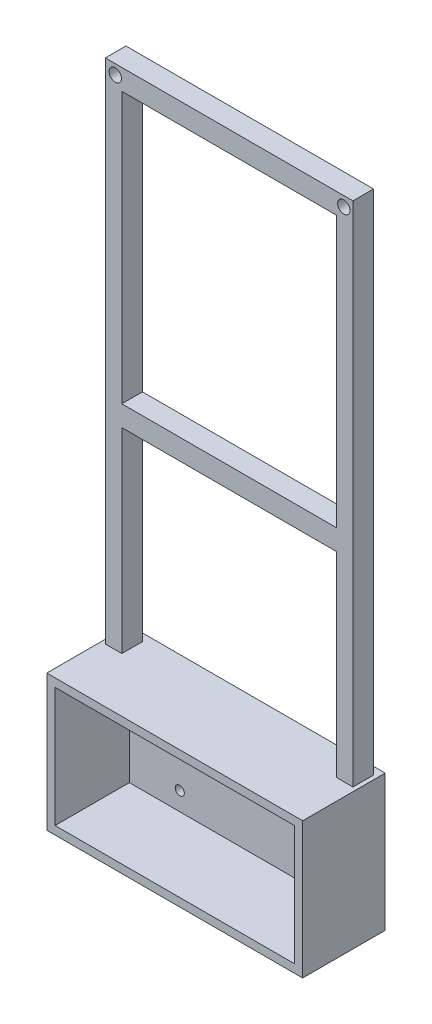
from build123d import *

# Parameters (mm, degrees)
SKETCH1_W           = 62
SKETCH1_H           = 33
BOSS_EXTRUDE1_DEPTH = 20
SHELL1_T            = -2
SKETCH2_W           = 4
SKETCH2_H           = 5
BOSS_EXTRUDE2_DEPTH = 123
SKETCH3_W           = 5
SKETCH3_H           = 5
BOSS_EXTRUDE3_DEPTH = 53
SKETCH4_W           = 5
SKETCH4_H           = 4.999777887
BOSS_EXTRUDE4_DEPTH = 53
SKETCH5_R           = 1.5
CUT_EXTRUDE1_DEPTH  = 53
SKETCH6_R           = 1.1
CUT_EXTRUDE2_DEPTH  = 10


with BuildPart() as part:
    # Sketch1 → Boss-Extrude1 (new body)
    with BuildSketch(Plane.XY):
        Rectangle(SKETCH1_W, SKETCH1_H)
    extrude(amount=BOSS_EXTRUDE1_DEPTH)

    # Shell1
    shell1_openings = [part.faces().sort_by_distance(p)[0] for p in [
        (0, 0, 20),
    ]]
    offset(amount=SHELL1_T, openings=shell1_openings, kind=Kind.INTERSECTION)

    # Sketch2 → Boss-Extrude2 (add)
    with BuildSketch(Plane(origin=(0, 16.5, 0), x_dir=(1, 0, 0), z_dir=(0, 1, 0))):
        with Locations((-28, -4.324522586)):
            Rectangle(SKETCH2_W, SKETCH2_H)
        with Locations((28, -4.324522586)):
            Rectangle(SKETCH2_W, SKETCH2_H)
    extrude(amount=BOSS_EXTRUDE2_DEPTH)

    # Sketch3 → Boss-Extrude3 (add)
    with BuildSketch(Plane(origin=(-26, 0, 0), x_dir=(0, 0, -1), z_dir=(1, 0, 0))):
        with Locations((-4.324522586, 66.417337004)):
            Rectangle(SKETCH3_W, SKETCH3_H)
    extrude(amount=BOSS_EXTRUDE3_DEPTH)

    # Sketch4 → Boss-Extrude4 (add)
    with BuildSketch(Plane(origin=(-26, 0, 0), x_dir=(0, 0, -1), z_dir=(1, 0, 0))):
        with Locations((-4.324522586, 137.000111057)):
            Rectangle(SKETCH4_W, SKETCH4_H)
    extrude(amount=BOSS_EXTRUDE4_DEPTH)

    # Sketch5 → Cut-Extrude1 (cut)
    with BuildSketch(Plane.XY.offset(6.824522586)):
        with Locations((-27.588179803, 137.122373113)):
            Circle(SKETCH5_R)
        with Locations((27.802254523, 137.122373113)):
            Circle(SKETCH5_R)
    extrude(amount=-CUT_EXTRUDE1_DEPTH, mode=Mode.SUBTRACT)

    # Sketch6 → Cut-Extrude2 (cut)
    with BuildSketch(Plane(origin=(0, 0, 0), x_dir=(-1, 0, 0), z_dir=(0, 0, -1))):
        with Locations((-18.21842794, 9.95930811)):
            Circle(SKETCH6_R)
        with Locations((-18.21842794, -10.04069189)):
            Circle(SKETCH6_R)
        with Locations((16.78157206, -10.04069189)):
            Circle(SKETCH6_R)
        with Locations((16.78157206, 9.95930811)):
            Circle(SKETCH6_R)
    extrude(amount=-CUT_EXTRUDE2_DEPTH, mode=Mode.SUBTRACT)


solid = part.part
